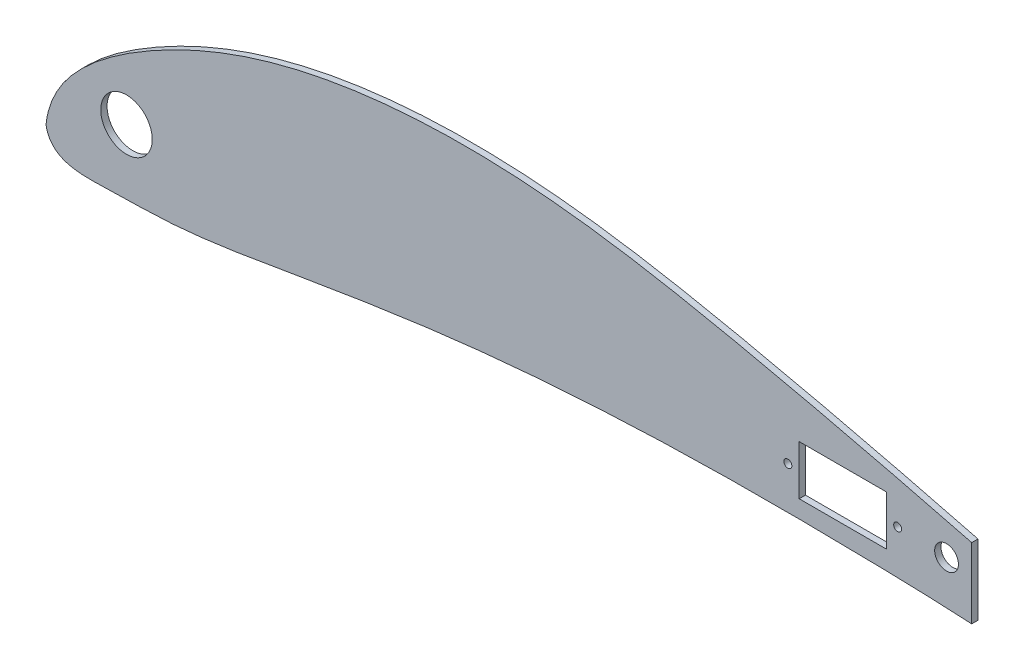
from build123d import *

# Parameters (mm, degrees)
BOSS_EXTRUDE1_DEPTH = 1.5875
SKETCH2_R           = 6.5
SKETCH2_R_2         = 3
CUT_EXTRUDE1_DEPTH  = 316.731983488
SKETCH3_W           = 116.84
SKETCH3_H           = 50.8
CUT_EXTRUDE2_DEPTH  = 316.731983488
SKETCH4_R           = 1.00076
SKETCH4_W           = 22
SKETCH4_H           = 12.5
CUT_EXTRUDE3_DEPTH  = 239.581081252


with BuildPart() as part:
    # Sketch1 → Boss-Extrude1 (new body)
    with BuildSketch(Plane.XY):
        with BuildLine():
            add(Edge.make_bspline(
                [(0.000560351, 0.000130087), (0.810633127, 7.359196055), (8.649092025, 17.856605174), (26.286719818, 29.975176328), (52.111128271, 42.069215275), (89.597618475, 49.290763054), (131.400792109, 47.884831915), (173.256699242, 40.041104278), (217.961060472, 29.612974894), (256.952064401, 19.528920948), (290.35983767, 8.71099439), (301.273197721, 4.382828139), (314.816918223, -0.516206742), (309.846313895, 0.000130087)],
                knots=[0, 0, 0, 0, 0.060863618, 0.113688265, 0.188608742, 0.312908923, 0.448482434, 0.557612135, 0.691544113, 0.852438279, 0.92975597, 0.976058229, 1, 1, 1, 1], degree=3))
            add(Edge.make_bspline(
                [(309.846313895, 0.000130087), (303.956832565, 1.47095521), (293.989507544, 2.093987313), (276.26402299, 4.514356704), (260.846344817, 5.427413394), (235.858814759, 7.870306192), (205.101424636, 8.838080282), (157.718638092, 9.030650149), (110.497331172, 6.181495223), (66.506197185, -0.586669107), (36.454672816, -6.098499901), (15.316603331, -6.189065841), (1.230714189, -6.924076091), (0.000560351, 0.000130087)],
                knots=[0, 0, 0, 0, 0.057787081, 0.095274891, 0.171021118, 0.205339302, 0.335319146, 0.464904334, 0.658702312, 0.785511947, 0.893517288, 0.94309214, 1, 1, 1, 1], degree=3))
        make_face()
    extrude(amount=BOSS_EXTRUDE1_DEPTH)

    # Sketch2 → Cut-Extrude1 (cut, through all)
    with BuildSketch(Plane.XY.offset(1.5875)):
        with Locations((20.32, 10.16)):
            Circle(SKETCH2_R)
        with Locations((227.296313895, 19.050130087)):
            Circle(SKETCH2_R_2)
    extrude(amount=-CUT_EXTRUDE1_DEPTH, mode=Mode.SUBTRACT)

    # Sketch3 → Cut-Extrude2 (cut, through all)
    with BuildSketch(Plane.XY.offset(1.5875)):
        with Locations((292.066313895, 19.050130087)):
            Rectangle(SKETCH3_W, SKETCH3_H)
    extrude(amount=-CUT_EXTRUDE2_DEPTH, mode=Mode.SUBTRACT)

    # Sketch4 → Cut-Extrude3 (cut, through all)
    with BuildSketch(Plane.XY.offset(1.5875)):
        with Locations((214.949245332, 19.518092278)):
            Circle(SKETCH4_R)
        with Locations((187.249245332, 19.518092278)):
            Circle(SKETCH4_R)
        with Locations((201.099245332, 19.518092278)):
            Rectangle(SKETCH4_W, SKETCH4_H)
    extrude(amount=-CUT_EXTRUDE3_DEPTH, mode=Mode.SUBTRACT)


solid = part.part
